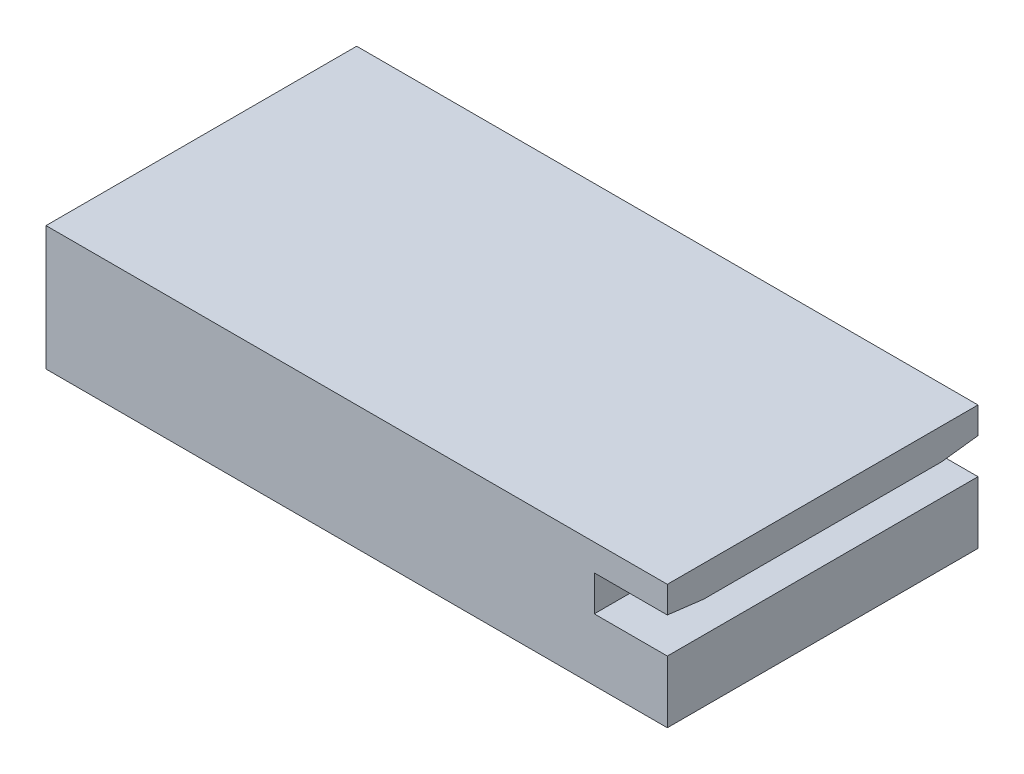
from build123d import *

# Parameters (mm, degrees)
SCHIZZO2_W                   = 2000
SCHIZZO2_H                   = 1000
ESTRUSIONE_ESTRUSIONE1_DEPTH = 400
SVUOTA1_T                    = 40
SCHIZZO3_W                   = 320
SCHIZZO3_H                   = 545
ESTRUSIONE_ESTRUSIONE2_DEPTH = 285
SCHIZZO5_R                   = 20
TAGLIO_ESTRUSIONE1_DEPTH     = 40
SCHIZZO7_W                   = 235.156084519
SCHIZZO7_H                   = 1000
TAGLIO_ESTRUSIONE2_DEPTH     = 100
ESTRUSIONE_ESTRUSIONE4_DEPTH = 920
TAGLIO_ESTRUSIONE3_DEPTH     = 235.156084519


with BuildPart() as part:
    # Schizzo2 → Estrusione-Estrusione1 (new body)
    with BuildSketch(Plane(origin=(0, 0, 0), x_dir=(1, 0, 0), z_dir=(0, 1, 0))):
        Rectangle(SCHIZZO2_W, SCHIZZO2_H)
    extrude(amount=ESTRUSIONE_ESTRUSIONE1_DEPTH)

    # Svuota1 (no face opened: a closed hollow body)
    add(offset(amount=-SVUOTA1_T, mode=Mode.PRIVATE), mode=Mode.SUBTRACT)

    # Schizzo3 → Estrusione-Estrusione2 (add)
    with BuildSketch(Plane(origin=(0, 40, 0), x_dir=(1, 0, 0), z_dir=(0, 1, 0))):
        Rectangle(SCHIZZO3_W, SCHIZZO3_H)
    extrude(amount=ESTRUSIONE_ESTRUSIONE2_DEPTH)

    # Schizzo5 → Taglio-Estrusione1 (cut)
    with BuildSketch(Plane.XZ):
        with Locations(Location((-780, 280, 0), (0, 0, 270))):
            Circle(SCHIZZO5_R)
        with Locations(Location((780, -280, 0), (0, 0, 270))):
            Circle(SCHIZZO5_R)
        with Locations(Location((854.59, 280, 0), (0, 0, 270))):
            Circle(SCHIZZO5_R)
        with Locations(Location((-705.41, -280, 0), (0, 0, 270))):
            Circle(SCHIZZO5_R)
    extrude(amount=-TAGLIO_ESTRUSIONE1_DEPTH, mode=Mode.SUBTRACT)

    # Schizzo7 → Taglio-Estrusione2 (cut)
    with BuildSketch(Plane(origin=(0, 200, 0), x_dir=(1, 0, 0), z_dir=(0, 1, 0))):
        with Locations((882.421957741, 0)):
            Rectangle(SCHIZZO7_W, SCHIZZO7_H)
    extrude(amount=TAGLIO_ESTRUSIONE2_DEPTH, mode=Mode.SUBTRACT)

    # Schizzo8 → Estrusione-Estrusione4 (add)
    with BuildSketch(Plane.XY.offset(-460)):
        Polygon((960, 320), (724.843915481, 320), (724.843915481, 180), (960, 180), (960, 200), (764.843915481, 200), (764.843915481, 300), (960, 300), align=None)
    extrude(amount=ESTRUSIONE_ESTRUSIONE4_DEPTH)

    # Schizzo9 → Taglio-Estrusione3 (cut)
    with BuildSketch(Plane(origin=(1000, 0, 0), x_dir=(0, 0, -1), z_dir=(1, 0, 0))):
        Polygon((-500, 300), (-500, 314.392280451), (-382.784282115, 300), align=None)
        Polygon((382.784282115, 300), (500, 300), (500, 314.392280451), align=None)
    extrude(amount=-TAGLIO_ESTRUSIONE3_DEPTH, mode=Mode.SUBTRACT)


solid = part.part
